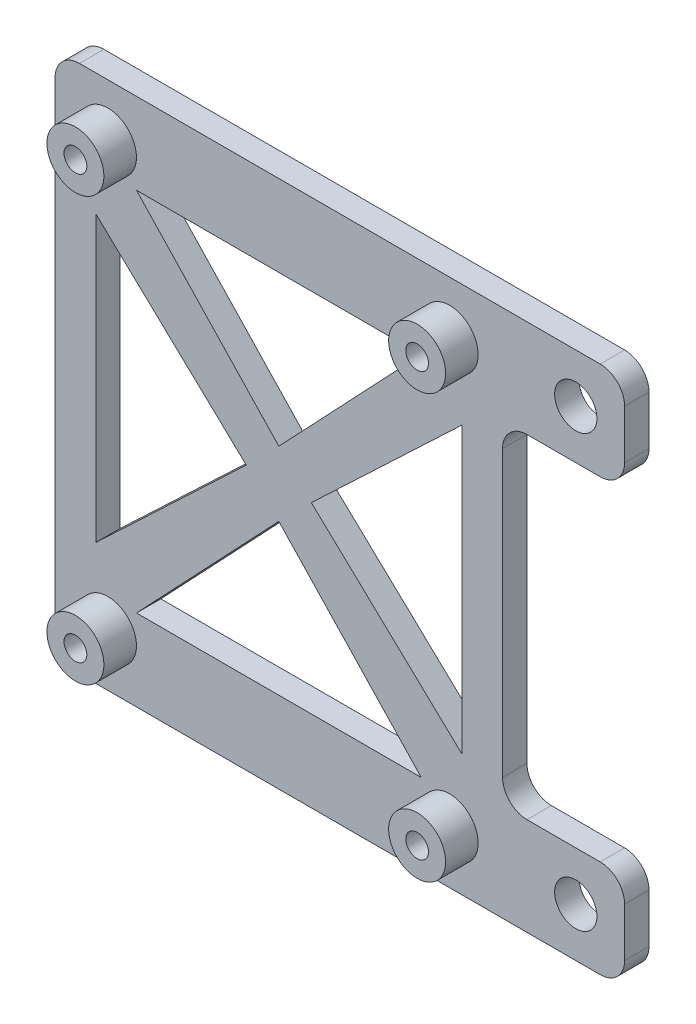
from build123d import *

# Parameters (mm, degrees)
SKETCH1_R           = 2.6
BOSS_EXTRUDE1_DEPTH = 3
SKETCH2_R           = 3.5
BOSS_EXTRUDE2_DEPTH = 4
CUT_EXTRUDE1_DEPTH  = 3
SKETCH4_R           = 1.4
CUT_EXTRUDE2_DEPTH  = 96.781000204


with BuildPart() as part:
    # Sketch1 → Boss-Extrude1 (new body)
    with BuildSketch(Plane.XY):
        with BuildLine():
            ThreePointArc((0, 3), (0.878679656, 0.878679656), (3, 0))
            Line((3, 0), (67, 0))
            ThreePointArc((67, 0), (69.121320344, 0.878679656), (70, 3))
            Line((70, 3), (70, 9))
            ThreePointArc((70, 9), (69.121320344, 11.121320344), (67, 12))
            Line((67, 12), (58, 12))
            ThreePointArc((58, 12), (55.878679656, 12.878679656), (55, 15))
            Line((55, 15), (55, 50))
            ThreePointArc((55, 50), (55.878679656, 52.121320344), (58, 53))
            Line((58, 53), (67, 53))
            ThreePointArc((67, 53), (69.121320344, 53.878679656), (70, 56))
            Line((70, 56), (70, 62))
            ThreePointArc((70, 62), (69.121320344, 64.121320344), (67, 65))
            Line((67, 65), (62, 65))
            Line((62, 65), (3, 65))
            ThreePointArc((3, 65), (0.878679656, 64.121320344), (0, 62))
            Line((0, 62), (0, 3))
        make_face()
        with Locations((64, 6)):
            Circle(SKETCH1_R, mode=Mode.SUBTRACT)
        with Locations((64, 59)):
            Circle(SKETCH1_R, mode=Mode.SUBTRACT)
    extrude(amount=BOSS_EXTRUDE1_DEPTH)

    # Sketch2 → Boss-Extrude2 (add)
    with BuildSketch(Plane.XY.offset(3)):
        with Locations((6.5, 58.5)):
            Circle(SKETCH2_R)
        with Locations((48.5, 58.5)):
            Circle(SKETCH2_R)
        with Locations((6.5, 6.5)):
            Circle(SKETCH2_R)
        with Locations((48.5, 6.5)):
            Circle(SKETCH2_R)
    extrude(amount=BOSS_EXTRUDE2_DEPTH)

    # Sketch3 → Cut-Extrude1 (cut)
    with BuildSketch(Plane.XY.offset(3)):
        Polygon((10, 55), (45, 55), (27.5, 36.5), align=None)
        Polygon((50, 50), (50, 15), (31.5, 32.5), align=None)
        Polygon((45, 10), (10, 10), (27.5, 28.5), align=None)
        Polygon((5, 15), (5, 50), (23.5, 32.5), align=None)
    extrude(amount=-CUT_EXTRUDE1_DEPTH, mode=Mode.SUBTRACT)

    # Sketch4 → Cut-Extrude2 (cut, through all)
    with BuildSketch(Plane.XY.offset(7)):
        with Locations((6.5, 58.5)):
            Circle(SKETCH4_R)
        with Locations((48.5, 6.5)):
            Circle(SKETCH4_R)
        with Locations((6.5, 6.5)):
            Circle(SKETCH4_R)
        with Locations((48.5, 58.5)):
            Circle(SKETCH4_R)
    extrude(amount=-CUT_EXTRUDE2_DEPTH, mode=Mode.SUBTRACT)


solid = part.part
